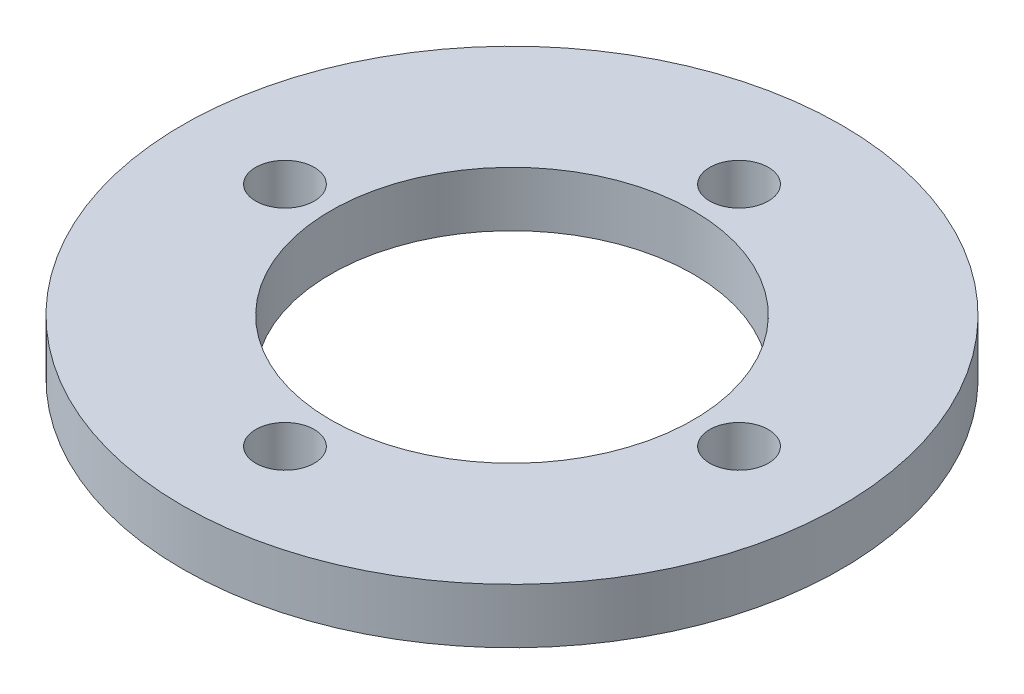
from build123d import *

# Parameters (mm, degrees)
SKETCH1_R           = 18
SKETCH1_R_2         = 9.9
SKETCH1_R_3         = 1.6
BOSS_EXTRUDE1_DEPTH = 3


with BuildPart() as part:
    # Sketch1 → Boss-Extrude1 (new body)
    with BuildSketch(Plane(origin=(0, 0, 0), x_dir=(1, 0, 0), z_dir=(0, 1, 0))):
        with Locations(Location((0, 0, 0), (0, 0, 270))):
            Circle(SKETCH1_R)
        with Locations(Location((0, 0, 0), (0, 0, 270))):
            Circle(SKETCH1_R_2, mode=Mode.SUBTRACT)
        with Locations(Location((0, 12.4, 0), (0, 0, 270))):
            Circle(SKETCH1_R_3, mode=Mode.SUBTRACT)
        with Locations(Location((12.4, 0, 0), (0, 0, 270))):
            Circle(SKETCH1_R_3, mode=Mode.SUBTRACT)
        with Locations(Location((0, -12.4, 0), (0, 0, 270))):
            Circle(SKETCH1_R_3, mode=Mode.SUBTRACT)
        with Locations(Location((-12.4, 0, 0), (0, 0, 270))):
            Circle(SKETCH1_R_3, mode=Mode.SUBTRACT)
    extrude(amount=BOSS_EXTRUDE1_DEPTH)


solid = part.part
